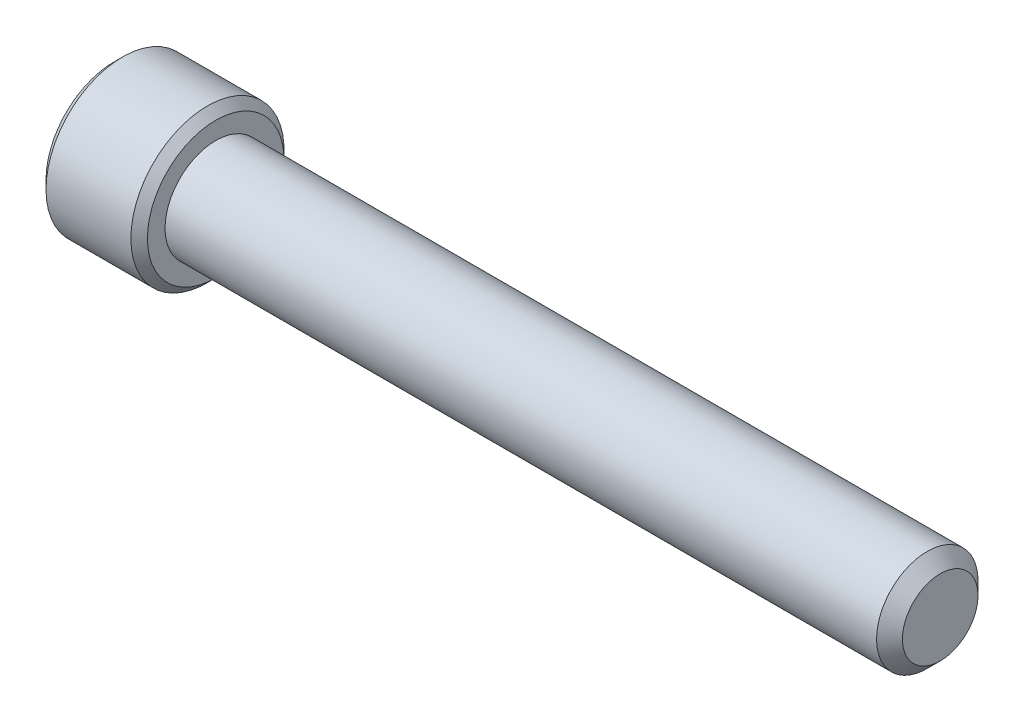
from build123d import *

# Parameters (mm, degrees)
EXTRUDE1_DEPTH = 3.81


with BuildPart() as part:
    # Sketch1 → Revolve1 (revolve)
    with BuildSketch(Plane.XY, mode=Mode.PRIVATE) as revolve1_sk:
        Polygon((25.3365, 0), (25.3365, 2.31775), (24.54275, 3.1115), (-19.1135, 3.1115), (-19.1135, 4.191), (-19.6215, 4.699), (-24.8285, 4.699), (-25.3365, 4.191), (-25.3365, 0), align=None)
    revolve(revolve1_sk.sketch.rotate(Axis((-124.874669814, 0, 0), (1, 0, 0)), 90), axis=Axis((-124.874669814, 0, 0), (1, 0, 0)))

    # Sketch2 → Extrude1 (cut)
    with BuildSketch(Plane.ZY.offset(25.3365)):
        Polygon((0, 2.749630657), (-2.38125, 1.374815329), (-2.38125, -1.374815329), (0, -2.749630657), (2.38125, -1.374815329), (2.38125, 1.374815329), align=None)
    extrude(amount=-EXTRUDE1_DEPTH, mode=Mode.SUBTRACT)


solid = part.part
